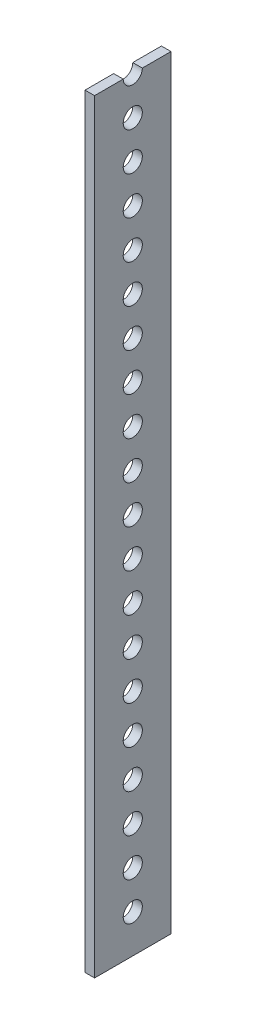
from build123d import *

# Parameters (mm, degrees)
SKETCH1_W               = 25.4
SKETCH1_H               = 1397
SKETCH1_R               = 3.175
BOSS_EXTRUDE1_DEPTH     = 3.175
CUT_EXTRUDE1_DEPTH      = 699.622659685
CUT_EXTRUDE1_DEPTH_BACK = 699.622659685
SKETCH2_W               = 25.4
SKETCH2_H               = 1143


with BuildPart() as part:
    # Sketch1 → Boss-Extrude1 (new body)
    with BuildSketch(Plane(origin=(0, 0, 0), x_dir=(0, 0, -1), z_dir=(1, 0, 0))):
        Rectangle(SKETCH1_W, SKETCH1_H)
        with Locations((0, -685.8)):
            Circle(SKETCH1_R, mode=Mode.SUBTRACT)
        with Locations((0, -673.1)):
            Circle(SKETCH1_R, mode=Mode.SUBTRACT)
        with Locations((0, -660.4)):
            Circle(SKETCH1_R, mode=Mode.SUBTRACT)
        with Locations((0, -647.7)):
            Circle(SKETCH1_R, mode=Mode.SUBTRACT)
        with Locations((0, -635)):
            Circle(SKETCH1_R, mode=Mode.SUBTRACT)
        with Locations((0, -622.3)):
            Circle(SKETCH1_R, mode=Mode.SUBTRACT)
        with Locations((0, -609.6)):
            Circle(SKETCH1_R, mode=Mode.SUBTRACT)
        with Locations((0, -596.9)):
            Circle(SKETCH1_R, mode=Mode.SUBTRACT)
        with Locations((0, -584.2)):
            Circle(SKETCH1_R, mode=Mode.SUBTRACT)
        with Locations((0, -571.5)):
            Circle(SKETCH1_R, mode=Mode.SUBTRACT)
        with Locations((0, -558.8)):
            Circle(SKETCH1_R, mode=Mode.SUBTRACT)
        with Locations((0, -546.1)):
            Circle(SKETCH1_R, mode=Mode.SUBTRACT)
        with Locations((0, -533.4)):
            Circle(SKETCH1_R, mode=Mode.SUBTRACT)
        with Locations((0, -520.7)):
            Circle(SKETCH1_R, mode=Mode.SUBTRACT)
        with Locations((0, -508)):
            Circle(SKETCH1_R, mode=Mode.SUBTRACT)
        with Locations((0, -495.3)):
            Circle(SKETCH1_R, mode=Mode.SUBTRACT)
        with Locations((0, -482.6)):
            Circle(SKETCH1_R, mode=Mode.SUBTRACT)
        with Locations((0, -469.9)):
            Circle(SKETCH1_R, mode=Mode.SUBTRACT)
        with Locations((0, -457.2)):
            Circle(SKETCH1_R, mode=Mode.SUBTRACT)
        with Locations((0, -444.5)):
            Circle(SKETCH1_R, mode=Mode.SUBTRACT)
        with Locations((0, -431.8)):
            Circle(SKETCH1_R, mode=Mode.SUBTRACT)
        with Locations((0, -419.1)):
            Circle(SKETCH1_R, mode=Mode.SUBTRACT)
        with Locations((0, -406.4)):
            Circle(SKETCH1_R, mode=Mode.SUBTRACT)
        with Locations((0, -393.7)):
            Circle(SKETCH1_R, mode=Mode.SUBTRACT)
        with Locations((0, -381)):
            Circle(SKETCH1_R, mode=Mode.SUBTRACT)
        with Locations((0, -368.3)):
            Circle(SKETCH1_R, mode=Mode.SUBTRACT)
        with Locations((0, -355.6)):
            Circle(SKETCH1_R, mode=Mode.SUBTRACT)
        with Locations((0, -342.9)):
            Circle(SKETCH1_R, mode=Mode.SUBTRACT)
        with Locations((0, -330.2)):
            Circle(SKETCH1_R, mode=Mode.SUBTRACT)
        with Locations((0, -317.5)):
            Circle(SKETCH1_R, mode=Mode.SUBTRACT)
        with Locations((0, -304.8)):
            Circle(SKETCH1_R, mode=Mode.SUBTRACT)
        with Locations((0, -292.1)):
            Circle(SKETCH1_R, mode=Mode.SUBTRACT)
        with Locations((0, -279.4)):
            Circle(SKETCH1_R, mode=Mode.SUBTRACT)
        with Locations((0, -266.7)):
            Circle(SKETCH1_R, mode=Mode.SUBTRACT)
        with Locations((0, -254)):
            Circle(SKETCH1_R, mode=Mode.SUBTRACT)
        with Locations((0, -241.3)):
            Circle(SKETCH1_R, mode=Mode.SUBTRACT)
        with Locations((0, -228.6)):
            Circle(SKETCH1_R, mode=Mode.SUBTRACT)
        with Locations((0, -215.9)):
            Circle(SKETCH1_R, mode=Mode.SUBTRACT)
        with Locations((0, -203.2)):
            Circle(SKETCH1_R, mode=Mode.SUBTRACT)
        with Locations((0, -190.5)):
            Circle(SKETCH1_R, mode=Mode.SUBTRACT)
        with Locations((0, -177.8)):
            Circle(SKETCH1_R, mode=Mode.SUBTRACT)
        with Locations((0, -165.1)):
            Circle(SKETCH1_R, mode=Mode.SUBTRACT)
        with Locations((0, -152.4)):
            Circle(SKETCH1_R, mode=Mode.SUBTRACT)
        with Locations((0, -139.7)):
            Circle(SKETCH1_R, mode=Mode.SUBTRACT)
        with Locations((0, -127)):
            Circle(SKETCH1_R, mode=Mode.SUBTRACT)
        with Locations((0, -114.3)):
            Circle(SKETCH1_R, mode=Mode.SUBTRACT)
        with Locations((0, -101.6)):
            Circle(SKETCH1_R, mode=Mode.SUBTRACT)
        with Locations((0, -88.9)):
            Circle(SKETCH1_R, mode=Mode.SUBTRACT)
        with Locations((0, -76.2)):
            Circle(SKETCH1_R, mode=Mode.SUBTRACT)
        with Locations((0, -63.5)):
            Circle(SKETCH1_R, mode=Mode.SUBTRACT)
        with Locations((0, -50.8)):
            Circle(SKETCH1_R, mode=Mode.SUBTRACT)
        with Locations((0, -38.1)):
            Circle(SKETCH1_R, mode=Mode.SUBTRACT)
        with Locations((0, -25.4)):
            Circle(SKETCH1_R, mode=Mode.SUBTRACT)
        with Locations((0, -12.7)):
            Circle(SKETCH1_R, mode=Mode.SUBTRACT)
        Circle(SKETCH1_R, mode=Mode.SUBTRACT)
        with Locations((0, 12.7)):
            Circle(SKETCH1_R, mode=Mode.SUBTRACT)
        with Locations((0, 25.4)):
            Circle(SKETCH1_R, mode=Mode.SUBTRACT)
        with Locations((0, 38.1)):
            Circle(SKETCH1_R, mode=Mode.SUBTRACT)
        with Locations((0, 50.8)):
            Circle(SKETCH1_R, mode=Mode.SUBTRACT)
        with Locations((0, 63.5)):
            Circle(SKETCH1_R, mode=Mode.SUBTRACT)
        with Locations((0, 76.2)):
            Circle(SKETCH1_R, mode=Mode.SUBTRACT)
        with Locations((0, 88.9)):
            Circle(SKETCH1_R, mode=Mode.SUBTRACT)
        with Locations((0, 101.6)):
            Circle(SKETCH1_R, mode=Mode.SUBTRACT)
        with Locations((0, 114.3)):
            Circle(SKETCH1_R, mode=Mode.SUBTRACT)
        with Locations((0, 127)):
            Circle(SKETCH1_R, mode=Mode.SUBTRACT)
        with Locations((0, 139.7)):
            Circle(SKETCH1_R, mode=Mode.SUBTRACT)
        with Locations((0, 152.4)):
            Circle(SKETCH1_R, mode=Mode.SUBTRACT)
        with Locations((0, 165.1)):
            Circle(SKETCH1_R, mode=Mode.SUBTRACT)
        with Locations((0, 177.8)):
            Circle(SKETCH1_R, mode=Mode.SUBTRACT)
        with Locations((0, 190.5)):
            Circle(SKETCH1_R, mode=Mode.SUBTRACT)
        with Locations((0, 203.2)):
            Circle(SKETCH1_R, mode=Mode.SUBTRACT)
        with Locations((0, 215.9)):
            Circle(SKETCH1_R, mode=Mode.SUBTRACT)
        with Locations((0, 228.6)):
            Circle(SKETCH1_R, mode=Mode.SUBTRACT)
        with Locations((0, 241.3)):
            Circle(SKETCH1_R, mode=Mode.SUBTRACT)
        with Locations((0, 254)):
            Circle(SKETCH1_R, mode=Mode.SUBTRACT)
        with Locations((0, 266.7)):
            Circle(SKETCH1_R, mode=Mode.SUBTRACT)
        with Locations((0, 279.4)):
            Circle(SKETCH1_R, mode=Mode.SUBTRACT)
        with Locations((0, 292.1)):
            Circle(SKETCH1_R, mode=Mode.SUBTRACT)
        with Locations((0, 304.8)):
            Circle(SKETCH1_R, mode=Mode.SUBTRACT)
        with Locations((0, 317.5)):
            Circle(SKETCH1_R, mode=Mode.SUBTRACT)
        with Locations((0, 330.2)):
            Circle(SKETCH1_R, mode=Mode.SUBTRACT)
        with Locations((0, 342.9)):
            Circle(SKETCH1_R, mode=Mode.SUBTRACT)
        with Locations((0, 355.6)):
            Circle(SKETCH1_R, mode=Mode.SUBTRACT)
        with Locations((0, 368.3)):
            Circle(SKETCH1_R, mode=Mode.SUBTRACT)
        with Locations((0, 381)):
            Circle(SKETCH1_R, mode=Mode.SUBTRACT)
        with Locations((0, 393.7)):
            Circle(SKETCH1_R, mode=Mode.SUBTRACT)
        with Locations((0, 406.4)):
            Circle(SKETCH1_R, mode=Mode.SUBTRACT)
        with Locations((0, 419.1)):
            Circle(SKETCH1_R, mode=Mode.SUBTRACT)
        with Locations((0, 431.8)):
            Circle(SKETCH1_R, mode=Mode.SUBTRACT)
        with Locations((0, 444.5)):
            Circle(SKETCH1_R, mode=Mode.SUBTRACT)
        with Locations((0, 457.2)):
            Circle(SKETCH1_R, mode=Mode.SUBTRACT)
        with Locations((0, 469.9)):
            Circle(SKETCH1_R, mode=Mode.SUBTRACT)
        with Locations((0, 482.6)):
            Circle(SKETCH1_R, mode=Mode.SUBTRACT)
        with Locations((0, 495.3)):
            Circle(SKETCH1_R, mode=Mode.SUBTRACT)
        with Locations((0, 508)):
            Circle(SKETCH1_R, mode=Mode.SUBTRACT)
        with Locations((0, 520.7)):
            Circle(SKETCH1_R, mode=Mode.SUBTRACT)
        with Locations((0, 533.4)):
            Circle(SKETCH1_R, mode=Mode.SUBTRACT)
        with Locations((0, 546.1)):
            Circle(SKETCH1_R, mode=Mode.SUBTRACT)
        with Locations((0, 558.8)):
            Circle(SKETCH1_R, mode=Mode.SUBTRACT)
        with Locations((0, 571.5)):
            Circle(SKETCH1_R, mode=Mode.SUBTRACT)
        with Locations((0, 584.2)):
            Circle(SKETCH1_R, mode=Mode.SUBTRACT)
        with Locations((0, 596.9)):
            Circle(SKETCH1_R, mode=Mode.SUBTRACT)
        with Locations((0, 609.6)):
            Circle(SKETCH1_R, mode=Mode.SUBTRACT)
        with Locations((0, 622.3)):
            Circle(SKETCH1_R, mode=Mode.SUBTRACT)
        with Locations((0, 635)):
            Circle(SKETCH1_R, mode=Mode.SUBTRACT)
        with Locations((0, 647.7)):
            Circle(SKETCH1_R, mode=Mode.SUBTRACT)
        with Locations((0, 660.4)):
            Circle(SKETCH1_R, mode=Mode.SUBTRACT)
        with Locations((0, 673.1)):
            Circle(SKETCH1_R, mode=Mode.SUBTRACT)
        with Locations((0, 685.8)):
            Circle(SKETCH1_R, mode=Mode.SUBTRACT)
    extrude(amount=BOSS_EXTRUDE1_DEPTH)

    # Sketch2 → Cut-Extrude1 (cut, two sides: drawn at the far end of the back side and taken through both)
    with BuildSketch(Plane(origin=(3.175, 0, 0), x_dir=(0, 0, -1), z_dir=(1, 0, 0)).offset(-CUT_EXTRUDE1_DEPTH_BACK)):
        with Locations((0, 127)):
            Rectangle(SKETCH2_W, SKETCH2_H)
    extrude(amount=CUT_EXTRUDE1_DEPTH + CUT_EXTRUDE1_DEPTH_BACK, mode=Mode.SUBTRACT)


solid = part.part
